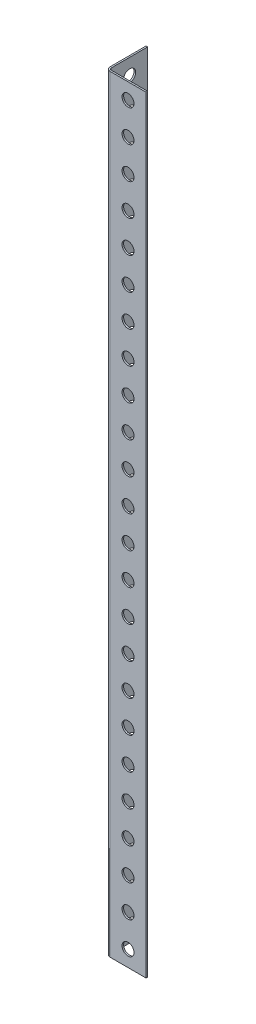
from build123d import *

# Parameters (mm, degrees)
BOSS_EXTRUDE1_DEPTH = 1219.2
SKETCH3_R           = 4.7625
CUT_EXTRUDE1_DEPTH  = 1.27
SKETCH4_R           = 4.7625
CUT_EXTRUDE2_DEPTH  = 1.27
FILLET1_R           = 3.175
FILLET2_R           = 1.5875
CUT_EXTRUDE3_DEPTH  = 609.6


with BuildPart() as part:
    # Sketch1 → Boss-Extrude1 (new body)
    with BuildSketch(Plane(origin=(0, 0, 0), x_dir=(1, 0, 0), z_dir=(0, 1, 0))):
        Polygon((1.27, 1.27), (1.27, 30.48), (1.27, 31.75), (0, 31.75), (0, 0), (31.75, 0), (31.75, 1.27), (30.48, 1.27), align=None)
    extrude(amount=BOSS_EXTRUDE1_DEPTH)

    # Sketch3 → Cut-Extrude1 (cut)
    with BuildSketch(Plane.ZY):
        with Locations((-17.4625, 12.7)):
            Circle(SKETCH3_R)
        with Locations((-17.4625, 38.1)):
            Circle(SKETCH3_R)
        with Locations((-17.4625, 63.5)):
            Circle(SKETCH3_R)
        with Locations((-17.4625, 88.9)):
            Circle(SKETCH3_R)
        with Locations((-17.4625, 114.3)):
            Circle(SKETCH3_R)
        with Locations((-17.4625, 139.7)):
            Circle(SKETCH3_R)
        with Locations((-17.4625, 165.1)):
            Circle(SKETCH3_R)
        with Locations((-17.4625, 190.5)):
            Circle(SKETCH3_R)
        with Locations((-17.4625, 215.9)):
            Circle(SKETCH3_R)
        with Locations((-17.4625, 241.3)):
            Circle(SKETCH3_R)
        with Locations((-17.4625, 266.7)):
            Circle(SKETCH3_R)
        with Locations((-17.4625, 292.1)):
            Circle(SKETCH3_R)
        with Locations((-17.4625, 317.5)):
            Circle(SKETCH3_R)
        with Locations((-17.4625, 342.9)):
            Circle(SKETCH3_R)
        with Locations((-17.4625, 368.3)):
            Circle(SKETCH3_R)
        with Locations((-17.4625, 393.7)):
            Circle(SKETCH3_R)
        with Locations((-17.4625, 419.1)):
            Circle(SKETCH3_R)
        with Locations((-17.4625, 444.5)):
            Circle(SKETCH3_R)
        with Locations((-17.4625, 469.9)):
            Circle(SKETCH3_R)
        with Locations((-17.4625, 495.3)):
            Circle(SKETCH3_R)
        with Locations((-17.4625, 520.7)):
            Circle(SKETCH3_R)
        with Locations((-17.4625, 546.1)):
            Circle(SKETCH3_R)
        with Locations((-17.4625, 571.5)):
            Circle(SKETCH3_R)
        with Locations((-17.4625, 596.9)):
            Circle(SKETCH3_R)
        with Locations((-17.4625, 622.3)):
            Circle(SKETCH3_R)
        with Locations((-17.4625, 647.7)):
            Circle(SKETCH3_R)
        with Locations((-17.4625, 673.1)):
            Circle(SKETCH3_R)
        with Locations((-17.4625, 698.5)):
            Circle(SKETCH3_R)
        with Locations((-17.4625, 723.9)):
            Circle(SKETCH3_R)
        with Locations((-17.4625, 749.3)):
            Circle(SKETCH3_R)
        with Locations((-17.4625, 774.7)):
            Circle(SKETCH3_R)
        with Locations((-17.4625, 800.1)):
            Circle(SKETCH3_R)
        with Locations((-17.4625, 825.5)):
            Circle(SKETCH3_R)
        with Locations((-17.4625, 850.9)):
            Circle(SKETCH3_R)
        with Locations((-17.4625, 876.3)):
            Circle(SKETCH3_R)
        with Locations((-17.4625, 901.7)):
            Circle(SKETCH3_R)
        with Locations((-17.4625, 927.1)):
            Circle(SKETCH3_R)
        with Locations((-17.4625, 952.5)):
            Circle(SKETCH3_R)
        with Locations((-17.4625, 977.9)):
            Circle(SKETCH3_R)
        with Locations((-17.4625, 1003.3)):
            Circle(SKETCH3_R)
        with Locations((-17.4625, 1028.7)):
            Circle(SKETCH3_R)
        with Locations((-17.4625, 1054.1)):
            Circle(SKETCH3_R)
        with Locations((-17.4625, 1079.5)):
            Circle(SKETCH3_R)
        with Locations((-17.4625, 1104.9)):
            Circle(SKETCH3_R)
        with Locations((-17.4625, 1130.3)):
            Circle(SKETCH3_R)
        with Locations((-17.4625, 1155.7)):
            Circle(SKETCH3_R)
        with Locations((-17.4625, 1181.1)):
            Circle(SKETCH3_R)
        with Locations((-17.4625, 1206.5)):
            Circle(SKETCH3_R)
    extrude(amount=-CUT_EXTRUDE1_DEPTH, mode=Mode.SUBTRACT)

    # Sketch4 → Cut-Extrude2 (cut)
    with BuildSketch(Plane.XY):
        with Locations((17.4625, 1206.5)):
            Circle(SKETCH4_R)
        with Locations((17.4625, 1181.1)):
            Circle(SKETCH4_R)
        with Locations((17.4625, 1155.7)):
            Circle(SKETCH4_R)
        with Locations((17.4625, 1130.3)):
            Circle(SKETCH4_R)
        with Locations((17.4625, 1104.9)):
            Circle(SKETCH4_R)
        with Locations((17.4625, 1079.5)):
            Circle(SKETCH4_R)
        with Locations((17.4625, 1054.1)):
            Circle(SKETCH4_R)
        with Locations((17.4625, 1028.7)):
            Circle(SKETCH4_R)
        with Locations((17.4625, 1003.3)):
            Circle(SKETCH4_R)
        with Locations((17.4625, 977.9)):
            Circle(SKETCH4_R)
        with Locations((17.4625, 952.5)):
            Circle(SKETCH4_R)
        with Locations((17.4625, 927.1)):
            Circle(SKETCH4_R)
        with Locations((17.4625, 901.7)):
            Circle(SKETCH4_R)
        with Locations((17.4625, 876.3)):
            Circle(SKETCH4_R)
        with Locations((17.4625, 850.9)):
            Circle(SKETCH4_R)
        with Locations((17.4625, 825.5)):
            Circle(SKETCH4_R)
        with Locations((17.4625, 800.1)):
            Circle(SKETCH4_R)
        with Locations((17.4625, 774.7)):
            Circle(SKETCH4_R)
        with Locations((17.4625, 749.3)):
            Circle(SKETCH4_R)
        with Locations((17.4625, 723.9)):
            Circle(SKETCH4_R)
        with Locations((17.4625, 698.5)):
            Circle(SKETCH4_R)
        with Locations((17.4625, 673.1)):
            Circle(SKETCH4_R)
        with Locations((17.4625, 647.7)):
            Circle(SKETCH4_R)
        with Locations((17.4625, 622.3)):
            Circle(SKETCH4_R)
        with Locations((17.4625, 596.9)):
            Circle(SKETCH4_R)
        with Locations((17.4625, 571.5)):
            Circle(SKETCH4_R)
        with Locations((17.4625, 546.1)):
            Circle(SKETCH4_R)
        with Locations((17.4625, 520.7)):
            Circle(SKETCH4_R)
        with Locations((17.4625, 495.3)):
            Circle(SKETCH4_R)
        with Locations((17.4625, 469.9)):
            Circle(SKETCH4_R)
        with Locations((17.4625, 444.5)):
            Circle(SKETCH4_R)
        with Locations((17.4625, 419.1)):
            Circle(SKETCH4_R)
        with Locations((17.4625, 393.7)):
            Circle(SKETCH4_R)
        with Locations((17.4625, 368.3)):
            Circle(SKETCH4_R)
        with Locations((17.4625, 342.9)):
            Circle(SKETCH4_R)
        with Locations((17.4625, 317.5)):
            Circle(SKETCH4_R)
        with Locations((17.4625, 292.1)):
            Circle(SKETCH4_R)
        with Locations((17.4625, 266.7)):
            Circle(SKETCH4_R)
        with Locations((17.4625, 241.3)):
            Circle(SKETCH4_R)
        with Locations((17.4625, 215.9)):
            Circle(SKETCH4_R)
        with Locations((17.4625, 190.5)):
            Circle(SKETCH4_R)
        with Locations((17.4625, 165.1)):
            Circle(SKETCH4_R)
        with Locations((17.4625, 139.7)):
            Circle(SKETCH4_R)
        with Locations((17.4625, 114.3)):
            Circle(SKETCH4_R)
        with Locations((17.4625, 88.9)):
            Circle(SKETCH4_R)
        with Locations((17.4625, 63.5)):
            Circle(SKETCH4_R)
        with Locations((17.4625, 38.1)):
            Circle(SKETCH4_R)
        with Locations((17.4625, 12.7)):
            Circle(SKETCH4_R)
    extrude(amount=-CUT_EXTRUDE2_DEPTH, mode=Mode.SUBTRACT)

    # Fillet1
    fillet1_edges = [part.edges().sort_by_distance(p)[0] for p in [
        (0, 609.6, 0),
    ]]
    fillet(fillet1_edges, radius=FILLET1_R)

    # Fillet2
    fillet2_edges = [part.edges().sort_by_distance(p)[0] for p in [
        (1.27, 609.6, -1.27),
    ]]
    fillet(fillet2_edges, radius=FILLET2_R)

    # Sketch5 → Cut-Extrude3 (cut)
    with BuildSketch(Plane(origin=(0, 1219.2, 0), x_dir=(1, 0, 0), z_dir=(0, 1, 0))):
        with BuildLine():
            Line((0, 31.75), (0, 3.175))
            ThreePointArc((0, 3.175), (0.92993597, 0.92993597), (3.175, 0))
            Line((3.175, 0), (31.75, 0))
            Line((31.75, 0), (31.75, 1.27))
            Line((31.75, 1.27), (2.8575, 1.27))
            ThreePointArc((2.8575, 1.27), (1.734967985, 1.734967985), (1.27, 2.8575))
            Line((1.27, 2.8575), (1.27, 31.75))
            Line((1.27, 31.75), (0, 31.75))
        make_face()
    extrude(amount=-CUT_EXTRUDE3_DEPTH, mode=Mode.SUBTRACT)


solid = part.part
